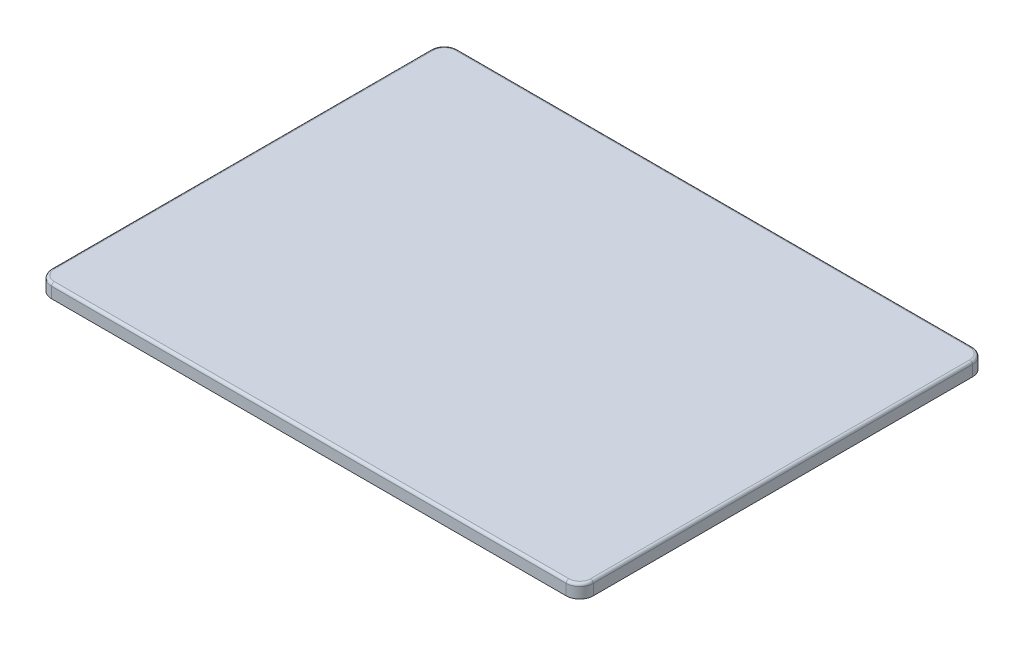
from build123d import *

# Parameters (mm, degrees)
SKETCH1_W           = 50.8
SKETCH1_H           = 38.1
BOSS_EXTRUDE1_DEPTH = 1.27
FILLET1_R           = 1.27
FILLET2_R           = 0.254


with BuildPart() as part:
    # Sketch1 → Boss-Extrude1 (new body)
    with BuildSketch(Plane(origin=(0, 0, 0), x_dir=(1, 0, 0), z_dir=(0, 1, 0))):
        Rectangle(SKETCH1_W, SKETCH1_H)
    extrude(amount=BOSS_EXTRUDE1_DEPTH)

    # Fillet1
    fillet1_edges = [part.edges().sort_by_distance(p)[0] for p in [
        (25.4, 0.635, 19.05),
        (-25.4, 0.635, 19.05),
        (-25.4, 0.635, -19.05),
        (25.4, 0.635, -19.05),
    ]]
    fillet(fillet1_edges, radius=FILLET1_R)

    # Fillet2
    fillet2_edges = [part.edges().sort_by_distance(p)[0] for p in [
        (25.4, 1.27, 0),
        (0, 1.27, 19.05),
        (0, 1.27, -19.05),
        (-25.4, 1.27, 0),
        (-25.028025612, 1.27, 18.678025612),
        (-25.028025612, 1.27, -18.678025612),
        (25.028025612, 1.27, -18.678025612),
        (25.028025612, 1.27, 18.678025612),
    ]]
    fillet(fillet2_edges, radius=FILLET2_R)


solid = part.part
